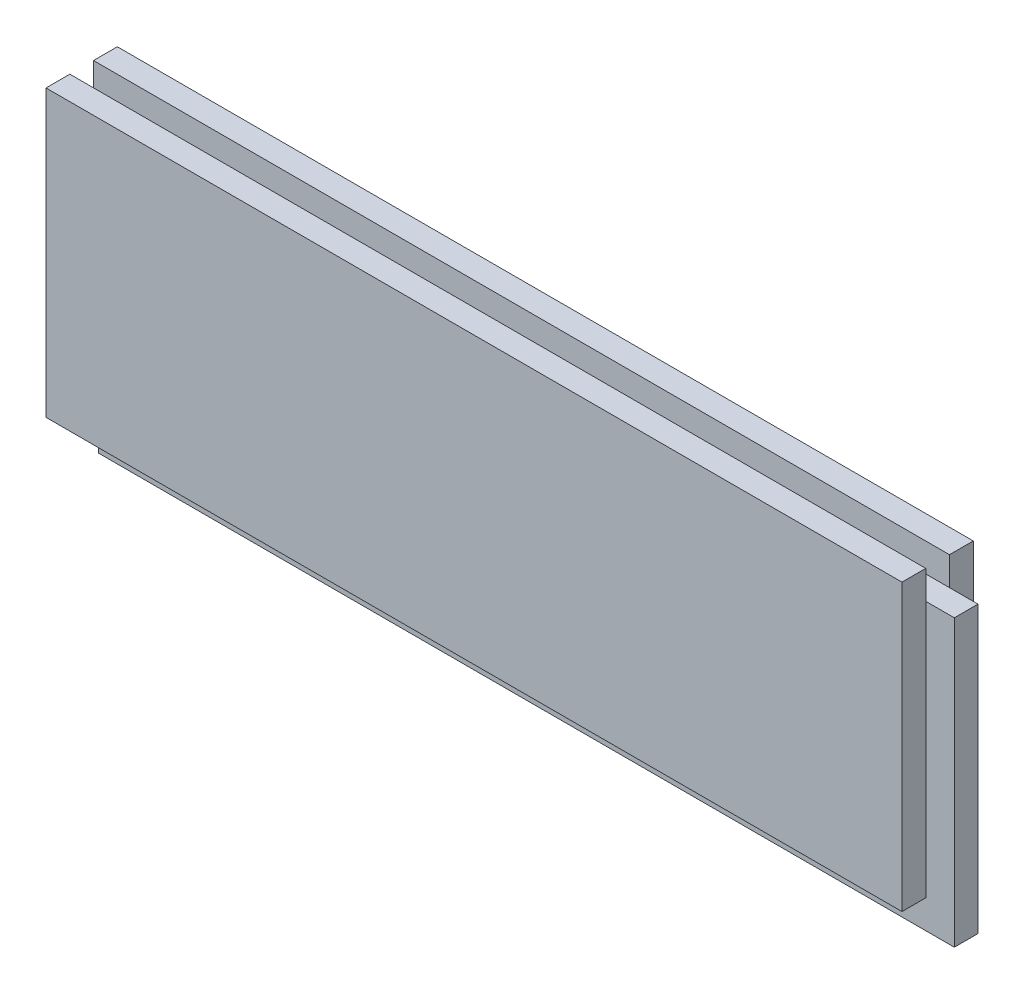
from build123d import *

# Parameters (mm, degrees)
SKETCH1_W           = 60
SKETCH1_H           = 20
BOSS_EXTRUDE1_DEPTH = 2.5
SKETCH2_W           = 60
SKETCH2_H           = 1.66
CUT_EXTRUDE1_DEPTH  = 2
SKETCH3_W           = 1.66
SKETCH3_H           = 18
CUT_EXTRUDE2_DEPTH  = 2
SKETCH4_W           = 58
SKETCH4_H           = 1.66
BOSS_EXTRUDE2_DEPTH = 2
SKETCH5_W           = 1.66
SKETCH5_H           = 20
BOSS_EXTRUDE3_DEPTH = 2


with BuildPart() as part:
    # Sketch1 → Boss-Extrude1 (new, symmetric)
    with BuildSketch(Plane.XY):
        Rectangle(SKETCH1_W, SKETCH1_H)
    extrude(amount=BOSS_EXTRUDE1_DEPTH, both=True)

    # Sketch2 → Cut-Extrude1 (cut)
    with BuildSketch(Plane(origin=(0, 10, 0), x_dir=(1, 0, 0), z_dir=(0, 1, 0))):
        Rectangle(SKETCH2_W, SKETCH2_H)
    extrude(amount=-CUT_EXTRUDE1_DEPTH, mode=Mode.SUBTRACT)

    # Sketch3 → Cut-Extrude2 (cut)
    with BuildSketch(Plane.ZY.offset(30)):
        with Locations((0, -1)):
            Rectangle(SKETCH3_W, SKETCH3_H)
    extrude(amount=-CUT_EXTRUDE2_DEPTH, mode=Mode.SUBTRACT)

    # Sketch4 → Boss-Extrude2 (add)
    with BuildSketch(Plane.XZ.offset(10)):
        with Locations((1, 0)):
            Rectangle(SKETCH4_W, SKETCH4_H)
    extrude(amount=BOSS_EXTRUDE2_DEPTH)

    # Sketch5 → Boss-Extrude3 (add)
    with BuildSketch(Plane(origin=(30, 0, 0), x_dir=(0, 0, -1), z_dir=(1, 0, 0))):
        with Locations((0, -2)):
            Rectangle(SKETCH5_W, SKETCH5_H)
    extrude(amount=BOSS_EXTRUDE3_DEPTH)


solid = part.part
